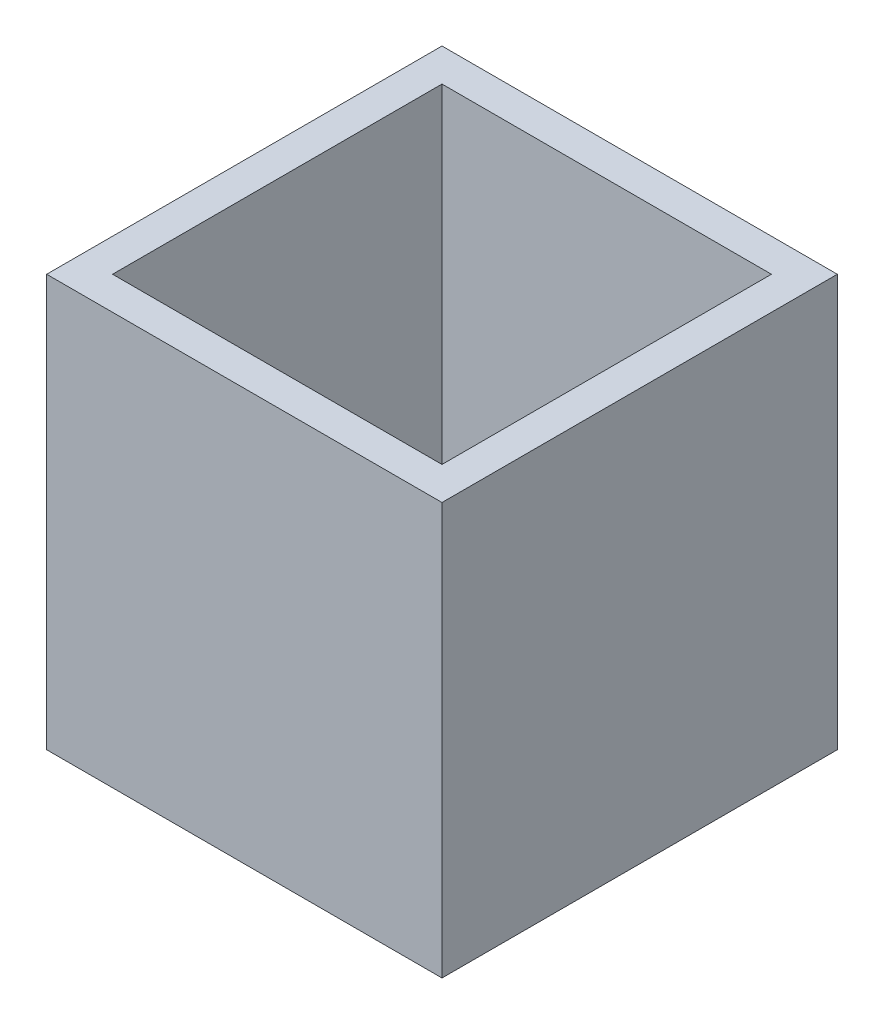
from build123d import *

# Parameters (mm, degrees)
SKETCH1_W           = 4.8
SKETCH1_H           = 4.8
SKETCH1_W_2         = 4
SKETCH1_H_2         = 4
BOSS_EXTRUDE1_DEPTH = 5


with BuildPart() as part:
    # Sketch1 → Boss-Extrude1 (new body)
    with BuildSketch(Plane(origin=(0, 0, 0), x_dir=(1, 0, 0), z_dir=(0, 1, 0))):
        Rectangle(SKETCH1_W, SKETCH1_H)
        Rectangle(SKETCH1_W_2, SKETCH1_H_2, mode=Mode.SUBTRACT)
    extrude(amount=BOSS_EXTRUDE1_DEPTH)


solid = part.part
